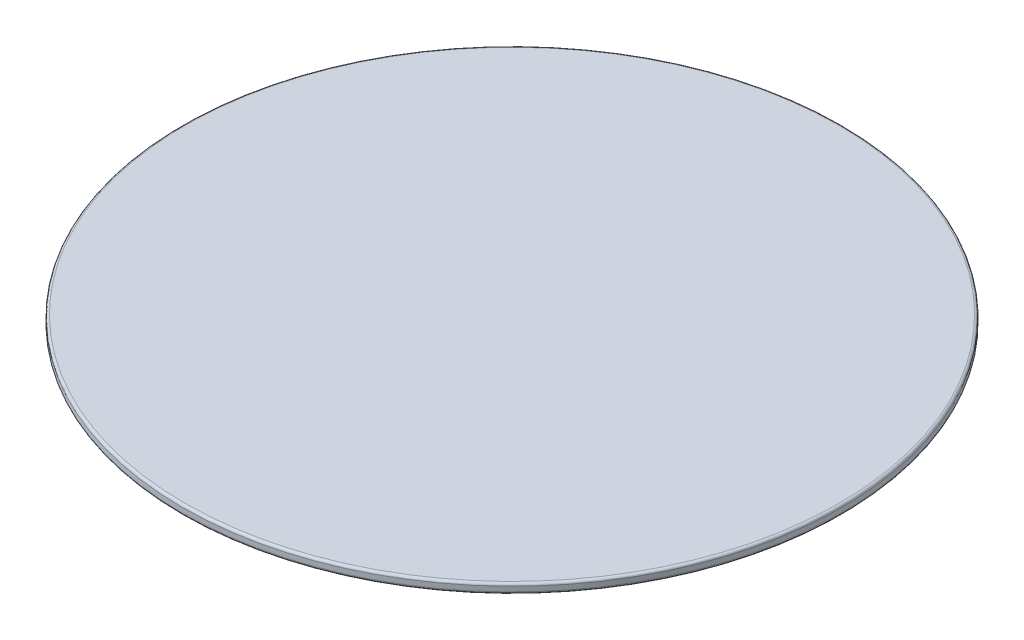
from build123d import *

# Parameters (mm, degrees)
SKETCH1_R           = 135
BOSS_EXTRUDE1_DEPTH = 4
FILLET1_R           = 1


with BuildPart() as part:
    # Sketch1 → Boss-Extrude1 (new body)
    with BuildSketch(Plane(origin=(0, 0, 0), x_dir=(1, 0, 0), z_dir=(0, 1, 0))):
        with Locations(Location((0, 0, 0), (0, 0, 270))):
            Circle(SKETCH1_R)
    extrude(amount=BOSS_EXTRUDE1_DEPTH)

    # Fillet1
    fillet1_edges = [part.edges().sort_by_distance(p)[0] for p in [
        (0, 0, -135),
        (0, 4, -135),
    ]]
    fillet(fillet1_edges, radius=FILLET1_R)


solid = part.part
